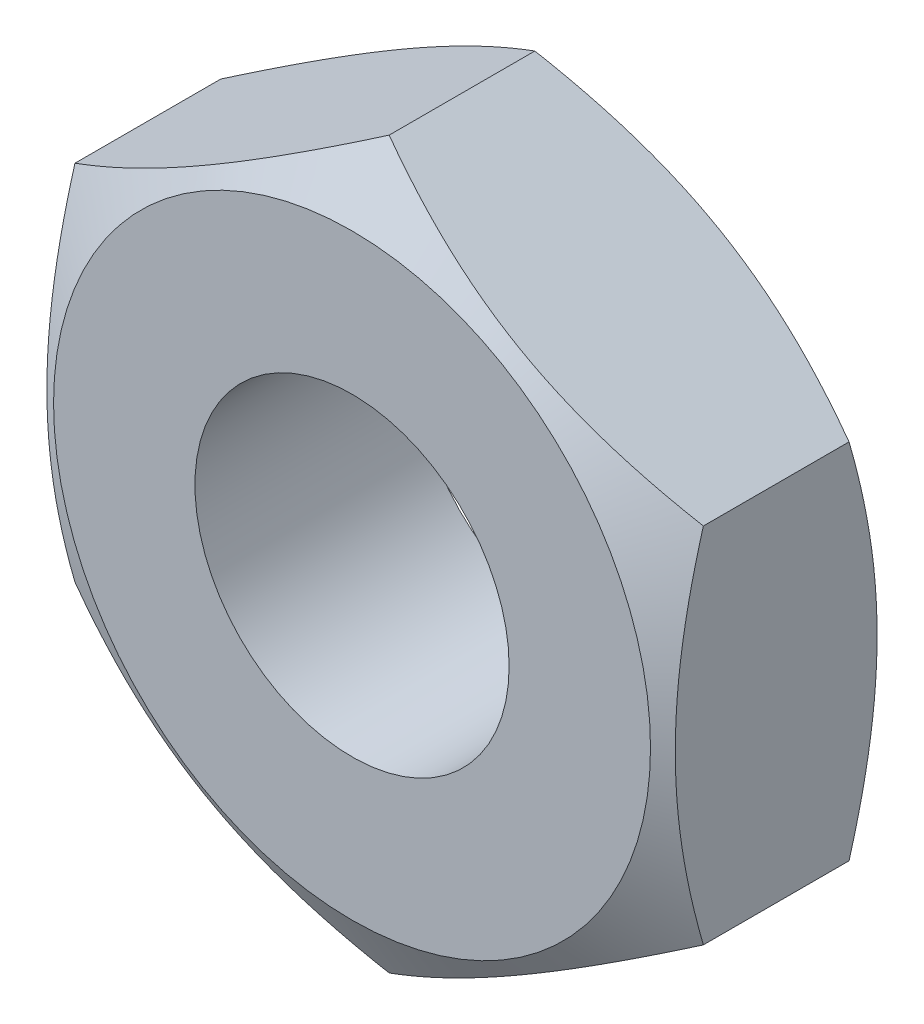
from build123d import *

# Parameters (mm, degrees)
SKETCH1_R      = 1.25
EXTRUDE1_DEPTH = 1.75


with BuildPart() as part:
    # Sketch1 → Extrude1 (new body)
    with BuildSketch(Plane.XY):
        Polygon((0, 2.886751346), (-2.5, 1.443375673), (-2.5, -1.443375673), (0, -2.886751346), (2.5, -1.443375673), (2.5, 1.443375673), align=None)
        Circle(SKETCH1_R, mode=Mode.SUBTRACT)
    extrude(amount=EXTRUDE1_DEPTH)

    # Sketch2 → Cut-Revolve1 (revolve, cut)
    with BuildSketch(Plane(origin=(0, 0, 0), x_dir=(0, 0, -1), z_dir=(1, 0, 0)), mode=Mode.PRIVATE) as cut_revolve1_sk:
        Polygon((-1.75, 2.375), (-1.097923928, 3.504428886), (-1.75, 3.504428886), align=None)
        Polygon((-0.652076072, 3.504428886), (0, 2.375), (0, 3.504428886), align=None)
    revolve(cut_revolve1_sk.sketch.rotate(Axis((0, 0, 1.75), (0, 0, -1)), 180), axis=Axis((0, 0, 1.75), (0, 0, -1)), mode=Mode.SUBTRACT)


solid = part.part
